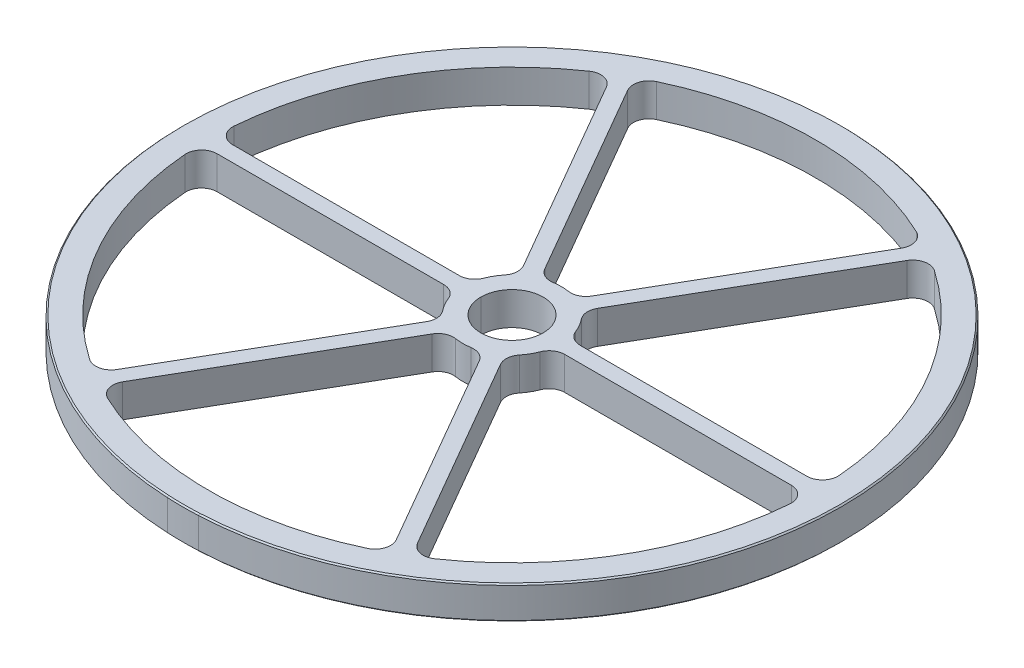
from build123d import *

# Parameters (mm, degrees)
SKETCH1_R           = 63.5
SKETCH1_R_2         = 6
BOSS_EXTRUDE3_DEPTH = 6.35
CHAMFER2_SIZE       = 0.25


with BuildPart() as part:
    # Sketch1 → Boss-Extrude3 (new body)
    with BuildSketch(Plane(origin=(0, 0, 0), x_dir=(1, 0, 0), z_dir=(0, 1, 0))):
        Circle(SKETCH1_R)
        Circle(SKETCH1_R_2, mode=Mode.SUBTRACT)
        with BuildLine():
            Line((-4.531913789, 10.849504938), (-26.359595266, 48.656158268))
            ThreePointArc((-26.359595266, 48.656158268), (-26.62540639, 51.049550304), (-25.04592549, 52.867301958))
            ThreePointArc((-25.04592549, 52.867301958), (0, 58.5), (25.04592549, 52.867301958))
            ThreePointArc((25.04592549, 52.867301958), (26.62540639, 51.049550304), (26.359595266, 48.656158268))
            Line((26.359595266, 48.656158268), (4.531913789, 10.849504938))
            ThreePointArc((4.531913789, 10.849504938), (3.227737969, 9.642879405), (1.469716559, 9.385623753))
            ThreePointArc((1.469716559, 9.385623753), (0, 9.5), (-1.469716559, 9.385623753))
            ThreePointArc((-1.469716559, 9.385623753), (-3.227737969, 9.642879405), (-4.531913789, 10.849504938))
        make_face(mode=Mode.SUBTRACT)
        with BuildLine():
            Line((7.129990001, 9.349504938), (28.957671478, 47.156158268))
            ThreePointArc((28.957671478, 47.156158268), (30.89750422, 48.583053472), (33.26146378, 48.124058715))
            ThreePointArc((33.26146378, 48.124058715), (50.662486121, 29.25), (58.30738927, 4.743243243))
            ThreePointArc((58.30738927, 4.743243243), (57.52291061, 2.466496832), (55.317266744, 1.5))
            Line((55.317266744, 1.5), (11.66190379, 1.5))
            ThreePointArc((11.66190379, 1.5), (9.964847515, 2.026136625), (8.86304688, 3.42))
            ThreePointArc((8.86304688, 3.42), (8.227241336, 4.75), (7.393330321, 5.965623753))
            ThreePointArc((7.393330321, 5.965623753), (6.737109546, 7.61674278), (7.129990001, 9.349504938))
        make_face(mode=Mode.SUBTRACT)
        with BuildLine():
            Line((11.66190379, -1.5), (55.317266744, -1.5))
            ThreePointArc((55.317266744, -1.5), (57.52291061, -2.466496832), (58.30738927, -4.743243243))
            ThreePointArc((58.30738927, -4.743243243), (50.662486121, -29.25), (33.26146378, -48.124058715))
            ThreePointArc((33.26146378, -48.124058715), (30.89750422, -48.583053472), (28.957671478, -47.156158268))
            Line((28.957671478, -47.156158268), (7.129990001, -9.349504938))
            ThreePointArc((7.129990001, -9.349504938), (6.737109546, -7.61674278), (7.393330321, -5.965623753))
            ThreePointArc((7.393330321, -5.965623753), (8.227241336, -4.75), (8.86304688, -3.42))
            ThreePointArc((8.86304688, -3.42), (9.964847515, -2.026136625), (11.66190379, -1.5))
        make_face(mode=Mode.SUBTRACT)
        with BuildLine():
            Line((4.531913789, -10.849504938), (26.359595266, -48.656158268))
            ThreePointArc((26.359595266, -48.656158268), (26.62540639, -51.049550304), (25.04592549, -52.867301958))
            ThreePointArc((25.04592549, -52.867301958), (0, -58.5), (-25.04592549, -52.867301958))
            ThreePointArc((-25.04592549, -52.867301958), (-26.62540639, -51.049550304), (-26.359595266, -48.656158268))
            Line((-26.359595266, -48.656158268), (-4.531913789, -10.849504938))
            ThreePointArc((-4.531913789, -10.849504938), (-3.227737969, -9.642879405), (-1.469716559, -9.385623753))
            ThreePointArc((-1.469716559, -9.385623753), (0, -9.5), (1.469716559, -9.385623753))
            ThreePointArc((1.469716559, -9.385623753), (3.227737969, -9.642879405), (4.531913789, -10.849504938))
        make_face(mode=Mode.SUBTRACT)
        with BuildLine():
            Line((-7.129990001, -9.349504938), (-28.957671478, -47.156158268))
            ThreePointArc((-28.957671478, -47.156158268), (-30.89750422, -48.583053472), (-33.26146378, -48.124058715))
            ThreePointArc((-33.26146378, -48.124058715), (-50.662486121, -29.25), (-58.30738927, -4.743243243))
            ThreePointArc((-58.30738927, -4.743243243), (-57.52291061, -2.466496832), (-55.317266744, -1.5))
            Line((-55.317266744, -1.5), (-11.66190379, -1.5))
            ThreePointArc((-11.66190379, -1.5), (-9.964847515, -2.026136625), (-8.86304688, -3.42))
            ThreePointArc((-8.86304688, -3.42), (-8.227241336, -4.75), (-7.393330321, -5.965623753))
            ThreePointArc((-7.393330321, -5.965623753), (-6.737109546, -7.61674278), (-7.129990001, -9.349504938))
        make_face(mode=Mode.SUBTRACT)
        with BuildLine():
            Line((-11.66190379, 1.5), (-55.317266744, 1.5))
            ThreePointArc((-55.317266744, 1.5), (-57.52291061, 2.466496832), (-58.30738927, 4.743243243))
            ThreePointArc((-58.30738927, 4.743243243), (-50.662486121, 29.25), (-33.26146378, 48.124058715))
            ThreePointArc((-33.26146378, 48.124058715), (-30.89750422, 48.583053472), (-28.957671478, 47.156158268))
            Line((-28.957671478, 47.156158268), (-7.129990001, 9.349504938))
            ThreePointArc((-7.129990001, 9.349504938), (-6.737109546, 7.61674278), (-7.393330321, 5.965623753))
            ThreePointArc((-7.393330321, 5.965623753), (-8.227241336, 4.75), (-8.86304688, 3.42))
            ThreePointArc((-8.86304688, 3.42), (-9.964847515, 2.026136625), (-11.66190379, 1.5))
        make_face(mode=Mode.SUBTRACT)
    extrude(amount=BOSS_EXTRUDE3_DEPTH)

    # Chamfer2
    chamfer2_edges = [part.edges().sort_by_distance(p)[0] for p in [
        (-63.5, 6.35, 0),
        (-63.5, 6.35, 0),
        (-63.5, 6.35, 0),
        (-63.5, 6.35, 0),
        (-63.5, 0, 0),
        (-63.5, 0, 0),
        (-63.5, 0, 0),
        (-63.5, 0, 0),
    ]]
    chamfer(chamfer2_edges, length=CHAMFER2_SIZE)


solid = part.part
